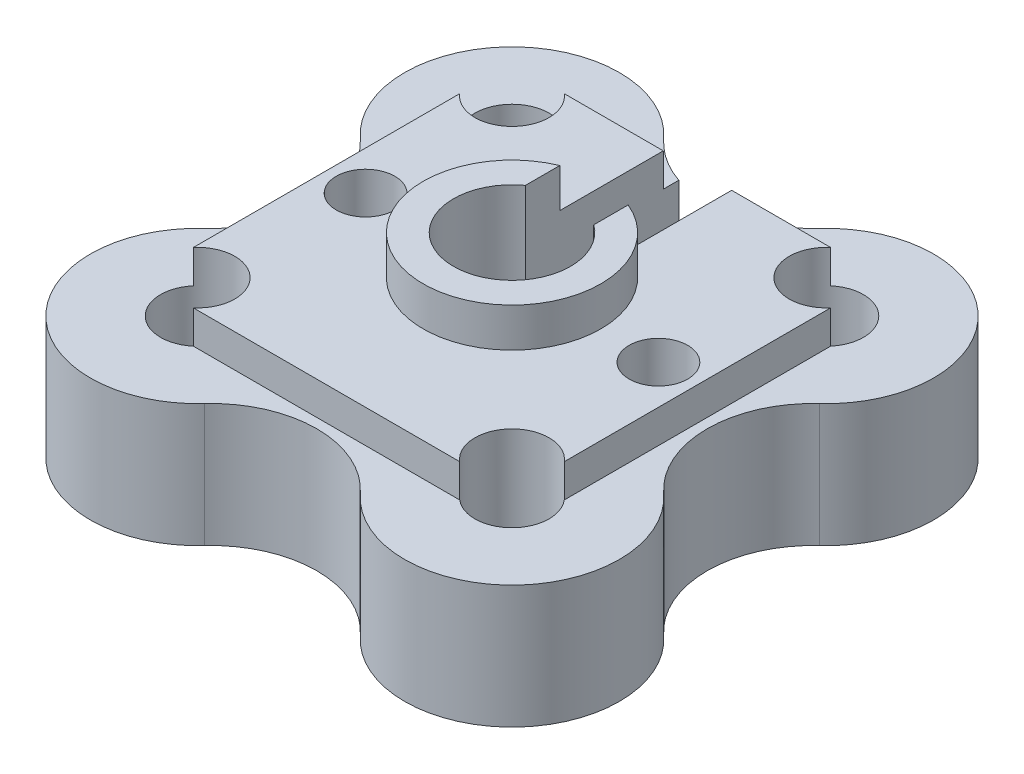
from build123d import *
from build123d.topology import SkipClean

# Parameters (mm, degrees)
SKETCH1_R           = 1.5
BOSS_EXTRUDE1_DEPTH = 6.3
SKETCH3_R           = 1.9
CUT_EXTRUDE3_DEPTH  = 5.3
BOSS_EXTRUDE2_START = 1.7
BOSS_EXTRUDE2_DEPTH = 1.7
SKETCH7_R           = 4.55
BOSS_EXTRUDE3_DEPTH = 2
SKETCH6_R           = 1.5
SKETCH6_R_2         = 3
CUT_EXTRUDE4_DEPTH  = 22.614925399
CUT_EXTRUDE5_DEPTH  = 22.614925399
BOSS_EXTRUDE4_DEPTH = 3.65


with BuildPart() as part:
    # Sketch1 → Boss-Extrude1 (new body)
    with BuildSketch(Plane(origin=(0, 0, 0), x_dir=(1, 0, 0), z_dir=(0, 1, 0))):
        with BuildLine():
            ThreePointArc((-3.988860539, -11.759062722), (-11.939087297, -11.939087297), (-11.759062722, -3.988860539))
            ThreePointArc((-11.759062722, -3.988860539), (-10, 0), (-11.759062722, 3.988860539))
            ThreePointArc((-11.759062722, 3.988860539), (-11.939087297, 11.939087297), (-3.988860539, 11.759062722))
            ThreePointArc((-3.988860539, 11.759062722), (0, 10), (3.988860539, 11.759062722))
            ThreePointArc((3.988860539, 11.759062722), (11.939087297, 11.939087297), (11.759062722, 3.988860539))
            ThreePointArc((11.759062722, 3.988860539), (10, 0), (11.759062722, -3.988860539))
            ThreePointArc((11.759062722, -3.988860539), (11.939087297, -11.939087297), (3.988860539, -11.759062722))
            ThreePointArc((3.988860539, -11.759062722), (0, -10), (-3.988860539, -11.759062722))
        make_face()
        with Locations(Location((-7.5, 0, 0), (0, 0, 270))):
            Circle(SKETCH1_R, mode=Mode.SUBTRACT)
        with Locations(Location((7.5, 0, 0), (0, 0, 270))):
            Circle(SKETCH1_R, mode=Mode.SUBTRACT)
    extrude(amount=BOSS_EXTRUDE1_DEPTH)

    # Sketch3 → Cut-Extrude3 (cut)
    with BuildSketch(Plane(origin=(0, 6.3, 0), x_dir=(1, 0, 0), z_dir=(0, 1, 0))):
        with Locations(Location((-8.05, 8.05, 0), (0, 0, 270))):
            Circle(SKETCH3_R)
        with Locations(Location((8.05, 8.05, 0), (0, 0, 270))):
            Circle(SKETCH3_R)
        with Locations(Location((8.05, -8.05, 0), (0, 0, 270))):
            Circle(SKETCH3_R)
        with Locations(Location((-8.05, -8.05, 0), (0, 0, 270))):
            Circle(SKETCH3_R)
    extrude(amount=-CUT_EXTRUDE3_DEPTH, mode=Mode.SUBTRACT)

    # Sketch5 → Boss-Extrude2 (add)
    with BuildSketch(Plane(origin=(0, 6.3, 0), x_dir=(1, 0, 0), z_dir=(0, 1, 0)).offset(BOSS_EXTRUDE2_START)):
        with BuildLine():
            Line((-9.5, 6.822197084), (-9.5, -6.822197084))
            ThreePointArc((-9.5, -6.822197084), (-6.706497116, -6.706497116), (-6.822197084, -9.5))
            Line((-6.822197084, -9.5), (6.822197084, -9.5))
            ThreePointArc((6.822197084, -9.5), (6.706497116, -6.706497116), (9.5, -6.822197084))
            Line((9.5, -6.822197084), (9.5, 6.822197084))
            ThreePointArc((9.5, 6.822197084), (6.706497116, 6.706497116), (6.822197084, 9.5))
            Line((6.822197084, 9.5), (-6.822197084, 9.5))
            ThreePointArc((-6.822197084, 9.5), (-6.706497116, 6.706497116), (-9.5, 6.822197084))
        make_face()
    extrude(amount=-BOSS_EXTRUDE2_DEPTH)

    # Sketch7 → Boss-Extrude3 (add)
    with BuildSketch(Plane(origin=(0, 8, 0), x_dir=(1, 0, 0), z_dir=(0, 1, 0))):
        with Locations(Location((0, 0, 0), (0, 0, 270))):
            Circle(SKETCH7_R)
    extrude(amount=BOSS_EXTRUDE3_DEPTH)

    # Sketch6 → Cut-Extrude4 (cut, through all)
    with BuildSketch(Plane(origin=(0, 0, 0), x_dir=(1, 0, 0), z_dir=(0, 1, 0))):
        with Locations(Location((-7.5, 0, 0), (0, 0, 270))):
            Circle(SKETCH6_R)
        with Locations(Location((0, 0, 0), (0, 0, 270))):
            Circle(SKETCH6_R_2)
        with Locations(Location((7.5, 0, 0), (0, 0, 270))):
            Circle(SKETCH6_R)
    extrude(amount=CUT_EXTRUDE4_DEPTH, mode=Mode.SUBTRACT)

    # Sketch8 → Cut-Extrude5 (cut, through all)
    with SkipClean():  # the faces are left unmerged after this step: merging them gives an invalid solid
        with BuildSketch(Plane(origin=(0, 10, 0), x_dir=(1, 0, 0), z_dir=(0, 1, 0))):
            with BuildLine():
                Line((-1.75, 0), (-1.75, 12))
                ThreePointArc((-1.75, 12), (0, 13.75), (1.75, 12))
                Line((1.75, 12), (1.75, 0))
                ThreePointArc((1.75, 0), (0, -1.75), (-1.75, 0))
            make_face()
        extrude(amount=-CUT_EXTRUDE5_DEPTH, mode=Mode.SUBTRACT)

    # Sketch9 → Boss-Extrude4 (add)
    with SkipClean():  # the faces are left unmerged after this step: merging them gives an invalid solid
        with BuildSketch(Plane.XZ):
            with BuildLine():
                Line((-1.75, -2.436698586), (-1.75, 0))
                ThreePointArc((-1.75, 0), (0, 1.75), (1.75, 0))
                Line((1.75, 0), (1.75, -2.436698586))
                ThreePointArc((1.75, -2.436698586), (0, 3), (-1.75, -2.436698586))
            make_face()
        extrude(amount=-BOSS_EXTRUDE4_DEPTH)


solid = part.part
